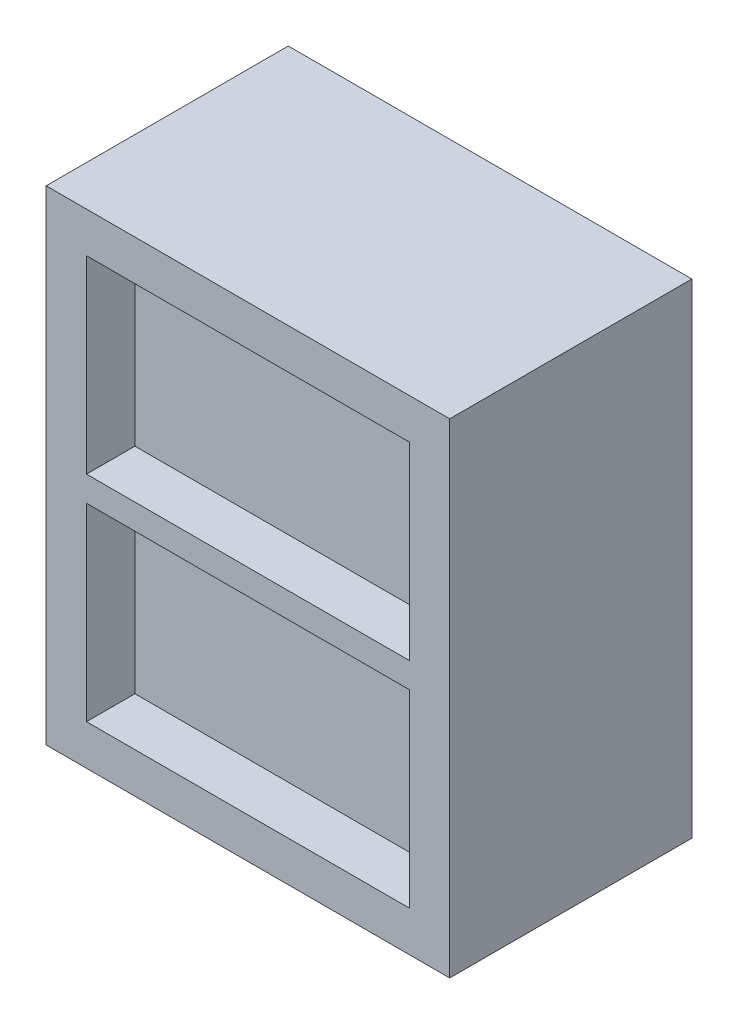
from build123d import *

# Parameters (mm, degrees)
CROQUIS2_W              = 2.5
CROQUIS2_H              = 3
SALIENTE_EXTRUIR1_DEPTH = 1.5
CROQUIS3_W              = 2
CROQUIS3_H              = 1.171875
CORTAR_EXTRUIR1_DEPTH   = 0.3


with BuildPart() as part:
    # Croquis2 → Saliente-Extruir1 (new body)
    with BuildSketch(Plane.XY):
        Rectangle(CROQUIS2_W, CROQUIS2_H)
    extrude(amount=SALIENTE_EXTRUIR1_DEPTH)

    # Croquis3 → Cortar-Extruir1 (cut)
    with BuildSketch(Plane.XY.offset(1.5)):
        Polygon((1, 1.25), (-1, 1.25), (-1, 0.078125), (1, 0.078125), (1, 0.15625), (1, 0.3125), (1, 0.625), align=None)
        with Locations((0, -0.6640625)):
            Rectangle(CROQUIS3_W, CROQUIS3_H)
    extrude(amount=-CORTAR_EXTRUIR1_DEPTH, mode=Mode.SUBTRACT)


solid = part.part
